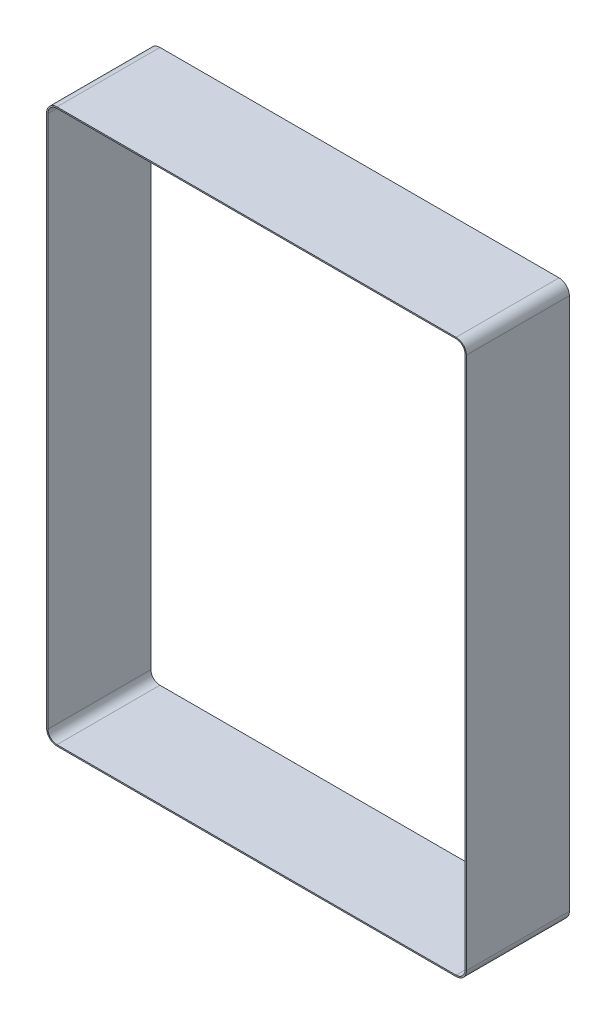
from build123d import *

# Parameters (mm, degrees)
BOSS_EXTRUDE1_DEPTH = 80


with BuildPart() as part:
    # Sketch1 → Boss-Extrude1 (new body)
    with BuildSketch(Plane.XY):
        with BuildLine():
            Line((155, -34.276790555), (-155, -34.276790555))
            ThreePointArc((-155, -34.276790555), (-160.656854249, -31.933644805), (-163, -26.276790555))
            Line((-163, -26.276790555), (-163, 387.723209445))
            ThreePointArc((-163, 387.723209445), (-160.656854249, 393.380063695), (-155, 395.723209445))
            Line((-155, 395.723209445), (155, 395.723209445))
            ThreePointArc((155, 395.723209445), (160.656854249, 393.380063695), (163, 387.723209445))
            Line((163, 387.723209445), (163, -26.276790555))
            ThreePointArc((163, -26.276790555), (160.656854249, -31.933644805), (155, -34.276790555))
        make_face()
        with BuildLine():
            Line((162, -26.276790555), (162, 387.723209445))
            ThreePointArc((162, 387.723209445), (159.949747468, 392.672956913), (155, 394.723209445))
            Line((155, 394.723209445), (-155, 394.723209445))
            ThreePointArc((-155, 394.723209445), (-159.949747468, 392.672956913), (-162, 387.723209445))
            Line((-162, 387.723209445), (-162, -26.276790555))
            ThreePointArc((-162, -26.276790555), (-159.949747468, -31.226538023), (-155, -33.276790555))
            Line((-155, -33.276790555), (155, -33.276790555))
            ThreePointArc((155, -33.276790555), (159.949747468, -31.226538023), (162, -26.276790555))
        make_face(mode=Mode.SUBTRACT)
    extrude(amount=BOSS_EXTRUDE1_DEPTH)


solid = part.part
